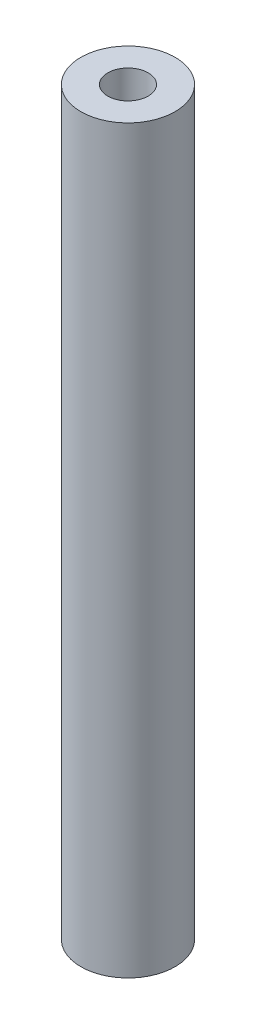
from build123d import *

# Parameters (mm, degrees)
SKETCH1_R           = 3.5
SKETCH1_R_2         = 1.5
BOSS_EXTRUDE1_DEPTH = 55


with BuildPart() as part:
    # Sketch1 → Boss-Extrude1 (new body)
    with BuildSketch(Plane(origin=(0, 0, 0), x_dir=(1, 0, 0), z_dir=(0, 1, 0))):
        with Locations(Location((0, 0, 0), (0, 0, 270))):
            Circle(SKETCH1_R)
        with Locations(Location((0, 0, 0), (0, 0, 270))):
            Circle(SKETCH1_R_2, mode=Mode.SUBTRACT)
    extrude(amount=BOSS_EXTRUDE1_DEPTH)


solid = part.part
